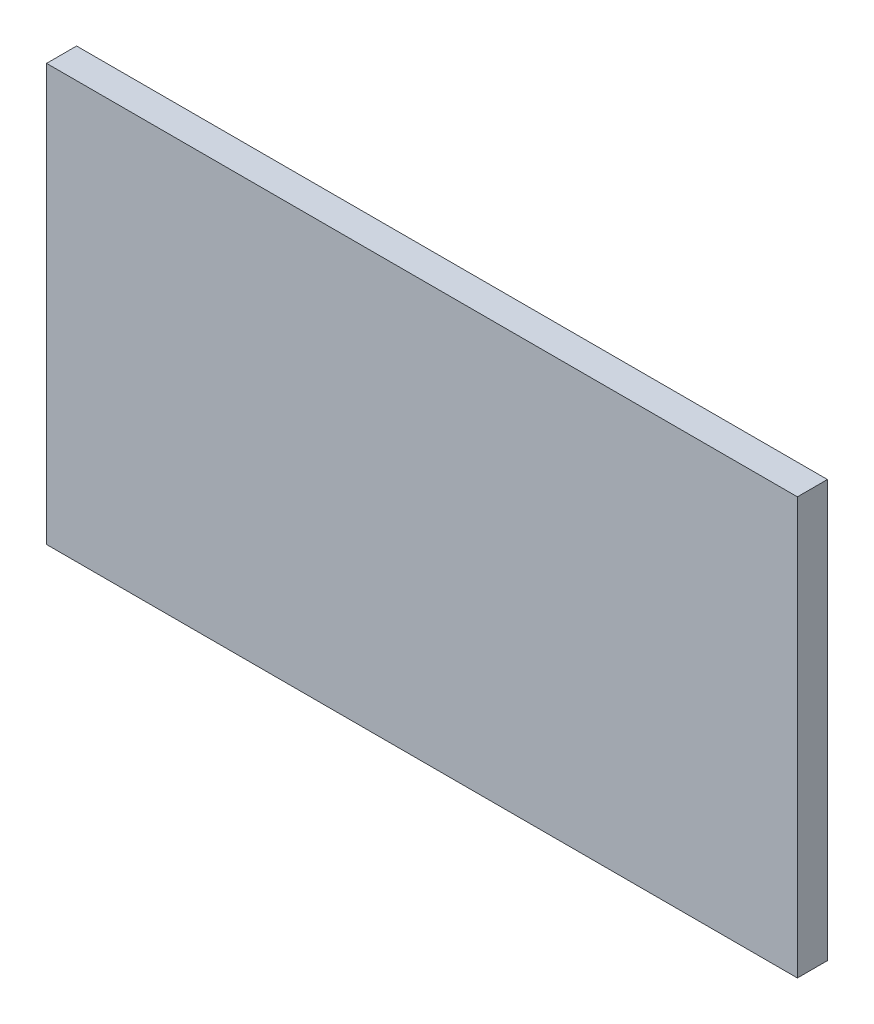
from build123d import *

# Parameters (mm, degrees)
SKETCH1_W           = 1000
SKETCH1_H           = 555
BOSS_EXTRUDE1_DEPTH = 40


with BuildPart() as part:
    # Sketch1 → Boss-Extrude1 (new body)
    with BuildSketch(Plane.XY):
        with Locations((0, -272.5)):
            Rectangle(SKETCH1_W, SKETCH1_H)
    extrude(amount=BOSS_EXTRUDE1_DEPTH)


solid = part.part
